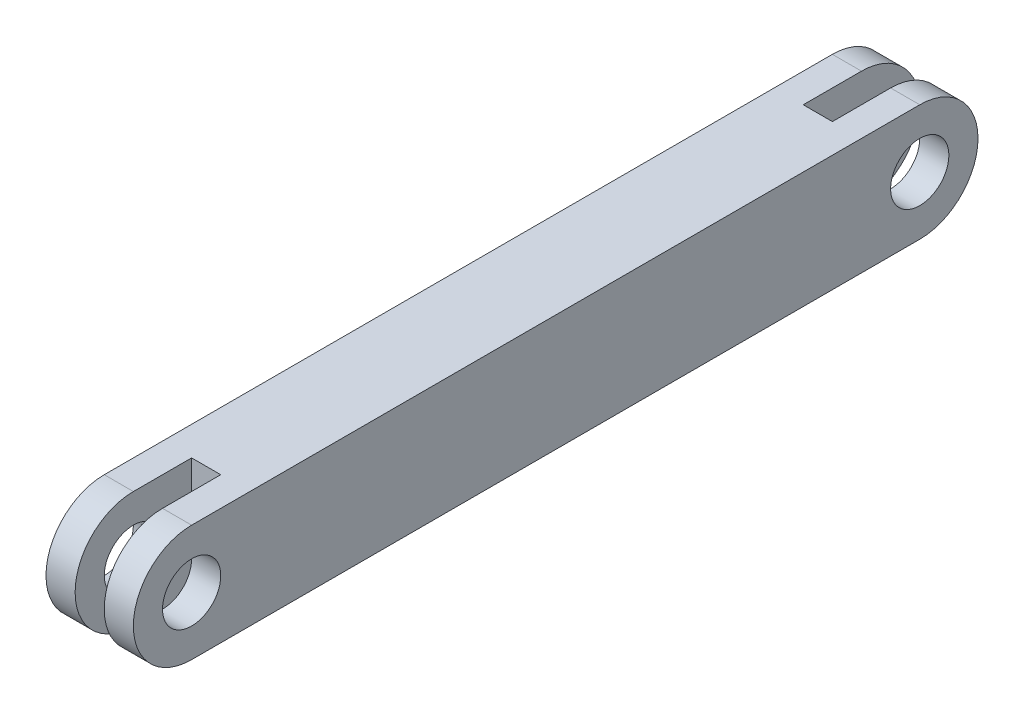
from build123d import *

# Parameters (mm, degrees)
SKETCH1_W           = 9.525
SKETCH1_H           = 12.7
BOSS_EXTRUDE1_DEPTH = 92.075
SKETCH2_W           = 3.175
SKETCH2_H           = 12.7
CUT_EXTRUDE1_DEPTH  = 168.784366554
SKETCH4_R           = 3.175
CUT_EXTRUDE3_DEPTH  = 99.934266019


with BuildPart() as part:
    # Sketch1 → Boss-Extrude1 (new body)
    with BuildSketch(Plane.XY):
        with Locations((134.924643413, -28.57073514)):
            Rectangle(SKETCH1_W, SKETCH1_H)
    extrude(amount=BOSS_EXTRUDE1_DEPTH)

    # Sketch2 → Cut-Extrude1 (cut, through all)
    with BuildSketch(Plane(origin=(0, -22.22073514, 0), x_dir=(1, 0, 0), z_dir=(0, 1, 0))):
        with Locations((134.924643413, -85.725)):
            Rectangle(SKETCH2_W, SKETCH2_H)
        with Locations((134.924643413, -6.35)):
            Rectangle(SKETCH2_W, SKETCH2_H)
    extrude(amount=-CUT_EXTRUDE1_DEPTH, mode=Mode.SUBTRACT)

    # Sketch4 → Cut-Extrude3 (cut, through all)
    with BuildSketch(Plane(origin=(139.687143413, 0, 0), x_dir=(0, 0, -1), z_dir=(1, 0, 0))):
        with BuildLine():
            ThreePointArc((-92.075, -28.57073514), (-90.215128061, -24.080607079), (-85.725, -22.22073514))
            Line((-85.725, -22.22073514), (-92.075, -22.22073514))
            Line((-92.075, -22.22073514), (-92.075, -28.57073514))
        make_face()
        with BuildLine():
            ThreePointArc((-85.725, -34.92073514), (-90.215128061, -33.060863201), (-92.075, -28.57073514))
            Line((-92.075, -28.57073514), (-92.075, -34.92073514))
            Line((-92.075, -34.92073514), (-85.725, -34.92073514))
        make_face()
        with BuildLine():
            Line((0, -22.22073514), (-6.35, -22.22073514))
            ThreePointArc((-6.35, -22.22073514), (-1.859871939, -24.080607079), (0, -28.57073514))
            Line((0, -28.57073514), (0, -22.22073514))
        make_face()
        with BuildLine():
            Line((0, -34.92073514), (0, -28.57073514))
            ThreePointArc((0, -28.57073514), (-1.859871939, -33.060863201), (-6.35, -34.92073514))
            Line((-6.35, -34.92073514), (0, -34.92073514))
        make_face()
        with Locations((-85.725, -28.57073514)):
            Circle(SKETCH4_R)
        with Locations((-6.35, -28.57073514)):
            Circle(SKETCH4_R)
    extrude(amount=-CUT_EXTRUDE3_DEPTH, mode=Mode.SUBTRACT)


solid = part.part
